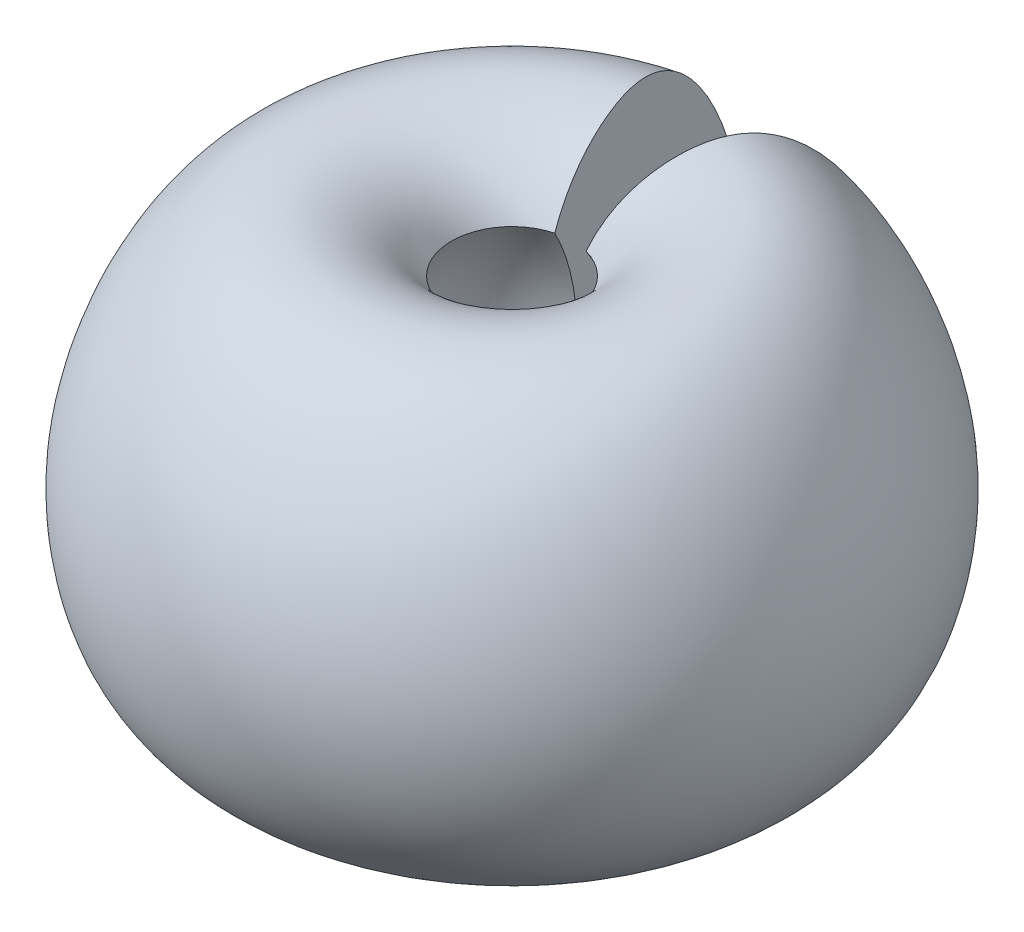
from build123d import *

# Parameters (mm, degrees)
REVOLUCI_N1_ANGLE = 330


with BuildPart() as part:
    # Croquis3 → Revolución1 (revolve, symmetric)
    with BuildSketch(Plane(origin=(0, 0, 0), x_dir=(0, 0, -1), z_dir=(1, 0, 0))) as revoluci_n1_sk:
        with BuildLine():
            ThreePointArc((-859, -900), (-769.357856831, -1597.787900588), (-424.666715761, -2211.083657387))
            add(Edge.make_bspline(
                [(-859, 2559), (-1168.754860127, 3110.590381493), (-1953.097939098, 3467.419321475), (-3655.080574974, 3280.965102055), (-4729.539898317, 1125.157646486), (-4610.459322874, -2994.453078955), (-1831.603191452, -3259.977622744), (-424.666715761, -2211.083657387)],
                knots=[0, 0, 0, 0, 0.088086731, 0.126076975, 0.351699616, 0.421493246, 1, 1, 1, 1], degree=3))
            ThreePointArc((-859, 2559), (-1193.902746214, 1811.038847156), (-1311.468574535, 1000))
            ThreePointArc((-1311.468574535, 1000), (-1536.835158071, -57.544843301), (-859, -900))
        make_face()
    revolve(axis=Axis((0, 0, 0), (0, 1, 0)), revolution_arc=REVOLUCI_N1_ANGLE / 2)
    revolve(revoluci_n1_sk.sketch, axis=Axis((0, 0, 0), (0, -1, 0)), revolution_arc=REVOLUCI_N1_ANGLE / 2)


solid = part.part
